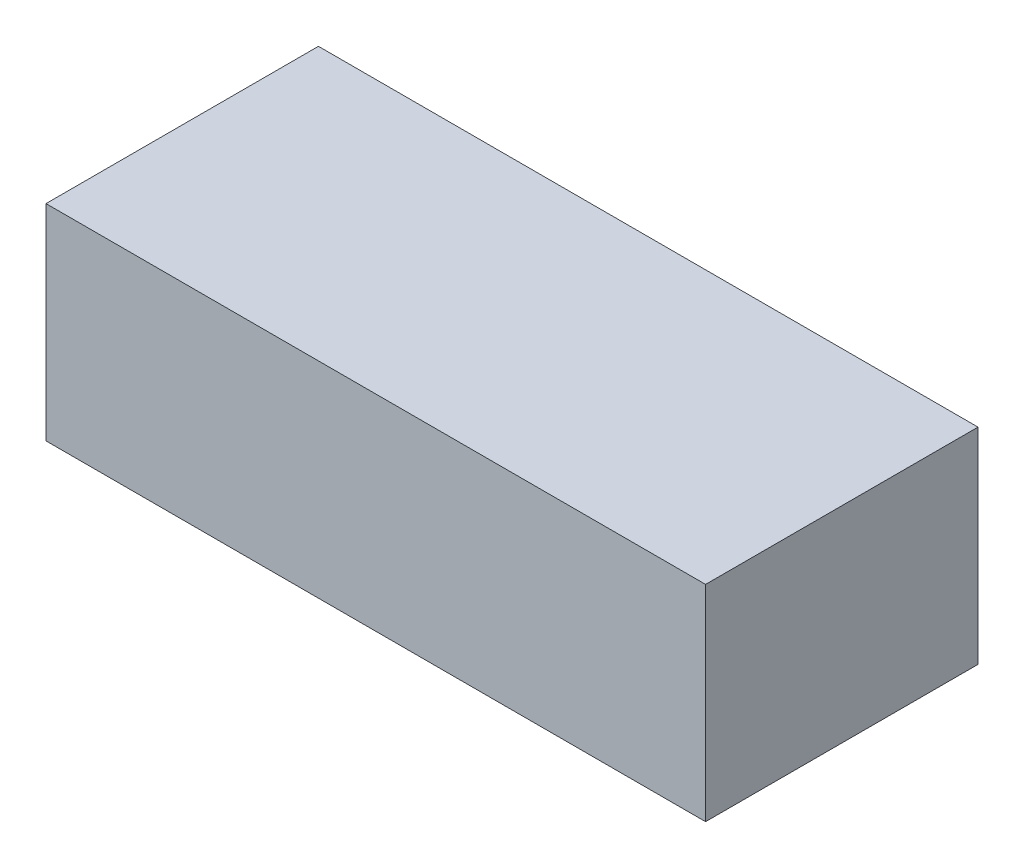
from build123d import *

# Parameters (mm, degrees)
SKETCH_1_W      = 138
SKETCH_1_H      = 43
EXTRUDE_1_DEPTH = 57


with BuildPart() as part:
    # 草图1 → 凸台-拉伸1 (new body)
    with BuildSketch(Plane.XY):
        Rectangle(SKETCH_1_W, SKETCH_1_H)
    extrude(amount=EXTRUDE_1_DEPTH)


solid = part.part
